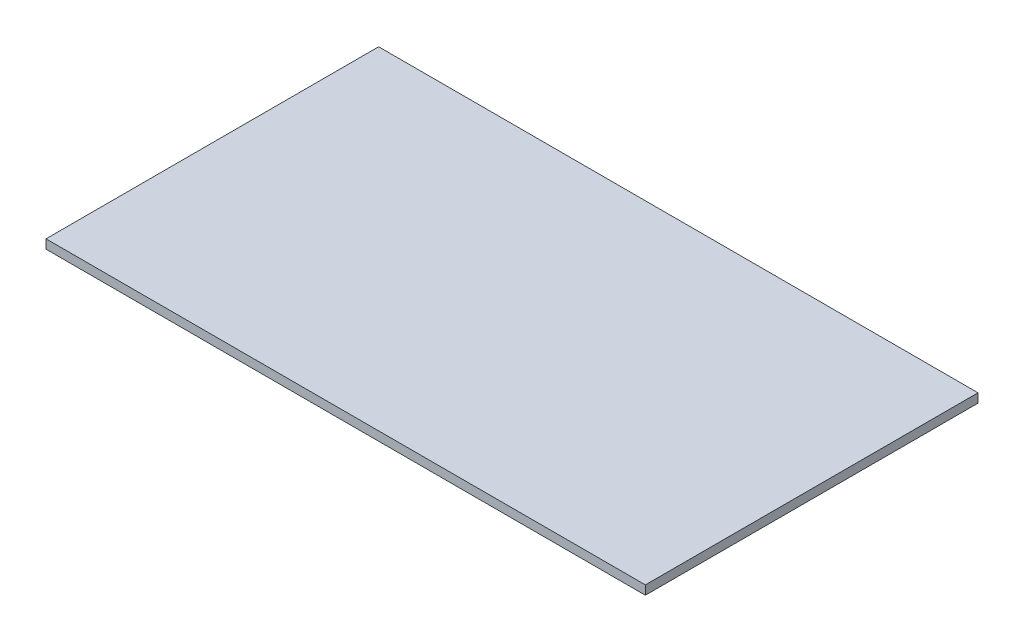
from build123d import *

# Parameters (mm, degrees)
SKETCH11_W          = 400
SKETCH11_H          = 222
BOSS_EXTRUDE1_DEPTH = 6


with BuildPart() as part:
    # Sketch11 → Boss-Extrude1 (new body)
    with BuildSketch(Plane(origin=(0, 0, 0), x_dir=(1, 0, 0), z_dir=(0, 1, 0))):
        with Locations((200, 111)):
            Rectangle(SKETCH11_W, SKETCH11_H)
    extrude(amount=BOSS_EXTRUDE1_DEPTH)


solid = part.part
